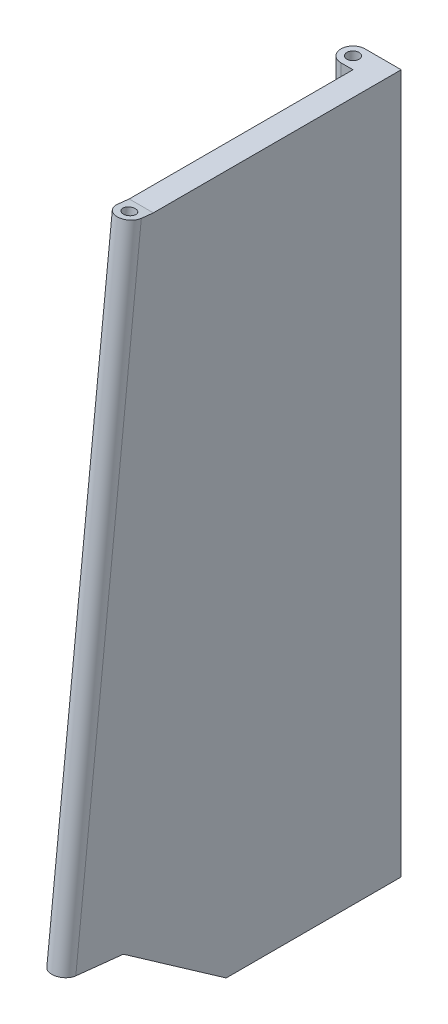
from build123d import *

# Parameters (mm, degrees)
EXTRUDE_1_DEPTH = 2
SKETCH_3_R      = 0.5
EXTRUDE_3_DEPTH = 52
SKETCH_4_R      = 0.5
EXTRUDE_4_DEPTH = 58


with BuildPart() as part:
    # Эскиз1 → Бобышка-Вытянуть1 (new body)
    with BuildSketch(Plane(origin=(0, 0, 0), x_dir=(0, 0, -1), z_dir=(1, 0, 0))):
        Polygon((-26, 6.284861441), (-23.051215157, 5.974931665), (-14.51812841, 0), (0, 0), (0, 58), (-20.56451991, 58), align=None)
    extrude(amount=EXTRUDE_1_DEPTH)

    # Эскиз3 → Бобышка-Вытянуть3 (add)
    with BuildSketch(Plane(origin=(0, 3.513339809, -0.369266894), x_dir=(1, 0, 0), z_dir=(0, -0.9945218953682733, 0.10452846326765391))):
        with BuildLine():
            Line((0, 26.514516188), (0, 27.514516188))
            ThreePointArc((0, 27.514516188), (1, 28.514516188), (2, 27.514516188))
            Line((2, 27.514516188), (2, 26.514516188))
            Line((2, 26.514516188), (0, 26.514516188))
        make_face()
        with Locations(Location((1, 27.514516188, 0), (0, 0, 270))):
            Circle(SKETCH_3_R, mode=Mode.SUBTRACT)
    extrude(amount=-EXTRUDE_3_DEPTH)

    # Эскиз4 → Бобышка-Вытянуть4 (add)
    with BuildSketch(Plane(origin=(0, 0, 0), x_dir=(1, 0, 0), z_dir=(0, 1, 0))):
        with BuildLine():
            Line((-1, 0), (0, 0))
            Line((0, 0), (0, -2))
            Line((0, -2), (-1, -2))
            ThreePointArc((-1, -2), (-2, -1), (-1, 0))
        make_face()
        with Locations(Location((-1, -1, 0), (0, 0, 90))):
            Circle(SKETCH_4_R, mode=Mode.SUBTRACT)
    extrude(amount=EXTRUDE_4_DEPTH)


solid = part.part
